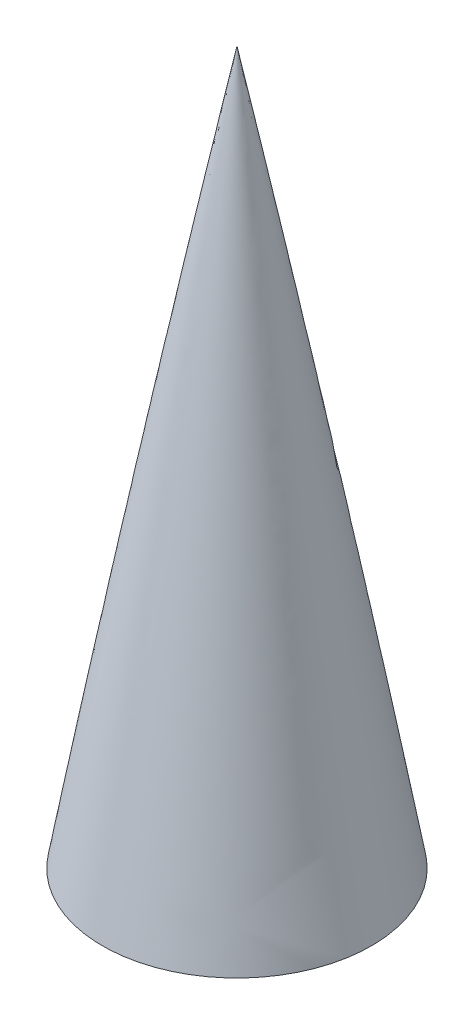
from build123d import *


with BuildPart() as part:
    # Sketch1 → Revolve1 (revolve)
    with BuildSketch(Plane.XY):
        with BuildLine():
            Line((2621.560843031, 177.8), (2626.36, 177.8))
            Line((2626.36, 177.8), (2626.36, 203.2))
            ThreePointArc((2626.36, 203.2), (2623.880438738, 190.515112201), (2621.560843031, 177.8))
        make_face()
    revolve(axis=Axis((2626.36, 177.8, 0), (0, 1, 0)))


solid = part.part
